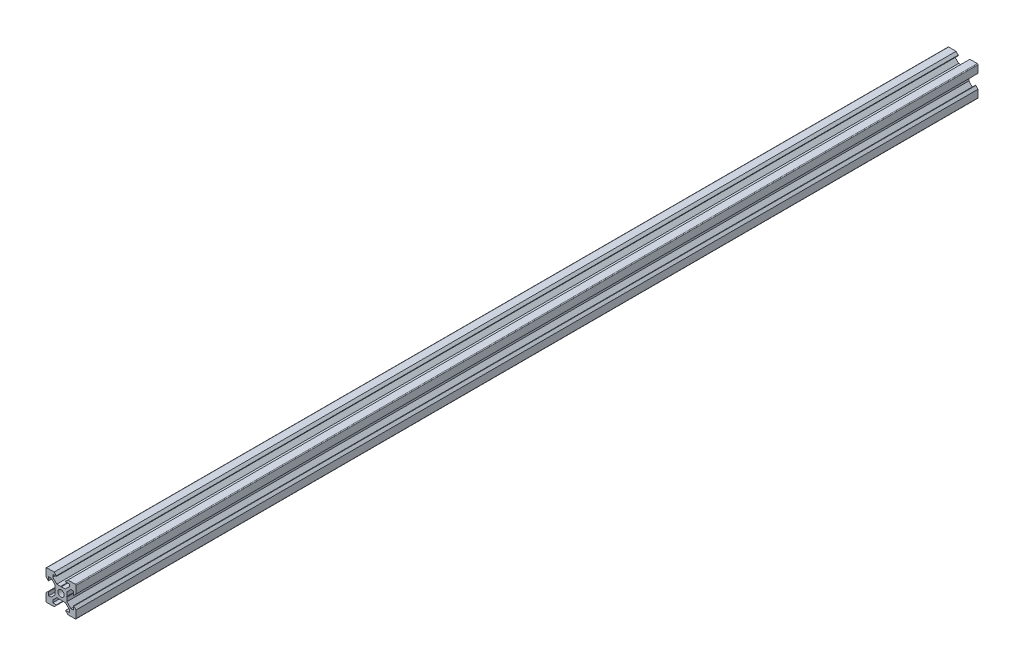
from build123d import *

# Parameters (mm, degrees)
BOSS_EXTRU_1_DEPTH           = 600
R_P_TITION_CIRCULAIRE1_COUNT = 4


with BuildPart() as part:
    # Esquisse1 → Boss.-Extru.1 (new body)
    with BuildSketch(Plane.XY):
        with BuildLine():
            Line((-9.5, 10), (-4.58, 10))
            Line((-4.58, 10), (-3.125, 8.545))
            Line((-3.125, 8.545), (-3.125, 8.2))
            Line((-3.125, 8.2), (-5.5, 8.2))
            Line((-5.5, 8.2), (-5.5, 6.560660172))
            Line((-5.5, 6.560660172), (-2.839339828, 3.9))
            Line((-2.839339828, 3.9), (-0.21, 3.9))
            Line((-0.21, 3.9), (0, 3.69))
            Line((0, 3.69), (0, 2.1))
            ThreePointArc((0, 2.1), (-1.48492424, 1.48492424), (-2.1, 0))
            Line((-2.1, 0), (-3.69, 0))
            Line((-3.69, 0), (-3.9, 0.21))
            Line((-3.9, 0.21), (-3.9, 2.839339828))
            Line((-3.9, 2.839339828), (-6.560660172, 5.5))
            Line((-6.560660172, 5.5), (-8.2, 5.5))
            Line((-8.2, 5.5), (-8.2, 3.125))
            Line((-8.2, 3.125), (-8.545, 3.125))
            Line((-8.545, 3.125), (-10, 4.58))
            Line((-10, 4.58), (-10, 9.5))
            ThreePointArc((-10, 9.5), (-9.853553391, 9.853553391), (-9.5, 10))
        make_face()
    boss_extru_1 = extrude(amount=BOSS_EXTRU_1_DEPTH)

    # Répétition circulaire1: Boss.-Extru.1 ×4 about axis
    r_p_tition_circulaire1_axis = Axis((0, 0, -13.782028156), (0, 0, 1))
    for i in range(1, R_P_TITION_CIRCULAIRE1_COUNT):
        add(boss_extru_1.rotate(r_p_tition_circulaire1_axis, i * 360 / R_P_TITION_CIRCULAIRE1_COUNT))


solid = part.part
